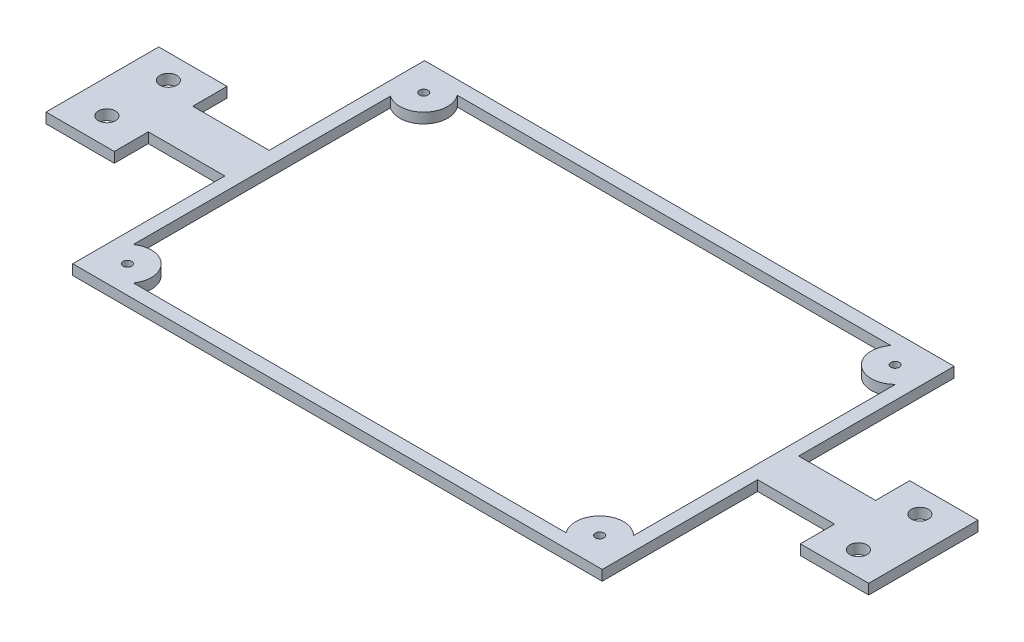
from build123d import *

# Parameters (mm, degrees)
SKETCH1_W            = 155
SKETCH1_H            = 103
SKETCH1_W_2          = 147
SKETCH1_H_2          = 95
BOSS_EXTRUDE2_DEPTH  = 3
SKETCH3_W            = 13
SKETCH3_H            = 3
BOSS_EXTRUDE5_DEPTH  = 22.5
SKETCH4_W            = 12
SKETCH4_H            = 3
BOSS_EXTRUDE6_DEPTH  = 22.5
SKETCH5_W            = 20
SKETCH5_H            = 32
SKETCH5_R            = 2.5
BOSS_EXTRUDE7_DEPTH  = 3
SKETCH6_W            = 20
SKETCH6_H            = 33
SKETCH6_R            = 2.5
BOSS_EXTRUDE8_DEPTH  = 3
SKETCH2_3_R          = 7
SKETCH2_3_R_2        = 1.25
BOSS_EXTRUDE11_DEPTH = 3
SKETCH2_R            = 7
SKETCH2_R_2          = 1.25
BOSS_EXTRUDE10_DEPTH = 3


with BuildPart() as part:
    # Sketch1 → Boss-Extrude2 (new body)
    with BuildSketch(Plane(origin=(0, 0, 0), x_dir=(1, 0, 0), z_dir=(0, 1, 0))):
        with Locations((77.5, 51.5)):
            Rectangle(SKETCH1_W, SKETCH1_H)
        with Locations((77.5, 51.5)):
            Rectangle(SKETCH1_W_2, SKETCH1_H_2, mode=Mode.SUBTRACT)
    extrude(amount=BOSS_EXTRUDE2_DEPTH)

    # Sketch3 → Boss-Extrude5 (add)
    with BuildSketch(Plane.ZY):
        with Locations((-51, 1.5)):
            Rectangle(SKETCH3_W, SKETCH3_H)
    extrude(amount=BOSS_EXTRUDE5_DEPTH)

    # Sketch4 → Boss-Extrude6 (add)
    with BuildSketch(Plane(origin=(155, 0, 0), x_dir=(0, 0, -1), z_dir=(1, 0, 0))):
        with Locations((51.5, 1.5)):
            Rectangle(SKETCH4_W, SKETCH4_H)
    extrude(amount=BOSS_EXTRUDE6_DEPTH)

    # Sketch5 → Boss-Extrude7 (add)
    with BuildSketch(Plane(origin=(0, 3, 0), x_dir=(1, 0, 0), z_dir=(0, 1, 0))):
        with Locations((187.5, 51.5)):
            Rectangle(SKETCH5_W, SKETCH5_H)
        with Locations((187.5, 60.5)):
            Circle(SKETCH5_R, mode=Mode.SUBTRACT)
        with Locations((187.5, 42.5)):
            Circle(SKETCH5_R, mode=Mode.SUBTRACT)
    extrude(amount=-BOSS_EXTRUDE7_DEPTH)

    # Sketch6 → Boss-Extrude8 (add)
    with BuildSketch(Plane(origin=(0, 3, 0), x_dir=(1, 0, 0), z_dir=(0, 1, 0))):
        with Locations((-32.378431073, 51.050390221)):
            Rectangle(SKETCH6_W, SKETCH6_H)
        with Locations((-32.5, 60.5)):
            Circle(SKETCH6_R, mode=Mode.SUBTRACT)
        with Locations((-32.5, 42.5)):
            Circle(SKETCH6_R, mode=Mode.SUBTRACT)
    extrude(amount=-BOSS_EXTRUDE8_DEPTH)

    # Sketch2<3> → Boss-Extrude11 (add)
    # profile 1 of 4: a face of its own
    with BuildSketch(Plane(origin=(0, 3, 0), x_dir=(1, 0, 0), z_dir=(0, 1, 0))):
        with Locations((8, 8)):
            Circle(SKETCH2_3_R)
        with Locations((8, 8)):
            Circle(SKETCH2_3_R_2, mode=Mode.SUBTRACT)
    # profile 2 of 4: a face of its own
    with BuildSketch(Plane(origin=(0, 3, 0), x_dir=(1, 0, 0), z_dir=(0, 1, 0))):
        with Locations((146, 8.25)):
            Circle(SKETCH2_3_R)
        with Locations((146, 8.25)):
            Circle(SKETCH2_3_R_2, mode=Mode.SUBTRACT)
    # profile 3 of 4: a face of its own
    with BuildSketch(Plane(origin=(0, 3, 0), x_dir=(1, 0, 0), z_dir=(0, 1, 0))):
        with Locations((8, 94.75)):
            Circle(SKETCH2_3_R)
        with Locations((8, 94.75)):
            Circle(SKETCH2_3_R_2, mode=Mode.SUBTRACT)
    # profile 4 of 4: a face of its own
    with BuildSketch(Plane(origin=(0, 3, 0), x_dir=(1, 0, 0), z_dir=(0, 1, 0))):
        with Locations((146, 94.75)):
            Circle(SKETCH2_3_R)
        with Locations((146, 94.75)):
            Circle(SKETCH2_3_R_2, mode=Mode.SUBTRACT)
    extrude(amount=-BOSS_EXTRUDE11_DEPTH)

    # Sketch2 → Boss-Extrude10 (add)
    # profile 1 of 4: a face of its own
    with BuildSketch(Plane(origin=(0, 3, 0), x_dir=(1, 0, 0), z_dir=(0, 1, 0))):
        with Locations((8, 8)):
            Circle(SKETCH2_R)
        with Locations((8, 8)):
            Circle(SKETCH2_R_2, mode=Mode.SUBTRACT)
    # profile 2 of 4: a face of its own
    with BuildSketch(Plane(origin=(0, 3, 0), x_dir=(1, 0, 0), z_dir=(0, 1, 0))):
        with Locations((146, 8.25)):
            Circle(SKETCH2_R)
        with Locations((146, 8.25)):
            Circle(SKETCH2_R_2, mode=Mode.SUBTRACT)
    # profile 3 of 4: a face of its own
    with BuildSketch(Plane(origin=(0, 3, 0), x_dir=(1, 0, 0), z_dir=(0, 1, 0))):
        with Locations((8, 94.75)):
            Circle(SKETCH2_R)
        with Locations((8, 94.75)):
            Circle(SKETCH2_R_2, mode=Mode.SUBTRACT)
    # profile 4 of 4: a face of its own
    with BuildSketch(Plane(origin=(0, 3, 0), x_dir=(1, 0, 0), z_dir=(0, 1, 0))):
        with Locations((146, 94.75)):
            Circle(SKETCH2_R)
        with Locations((146, 94.75)):
            Circle(SKETCH2_R_2, mode=Mode.SUBTRACT)
    extrude(amount=-BOSS_EXTRUDE10_DEPTH)


solid = part.part
